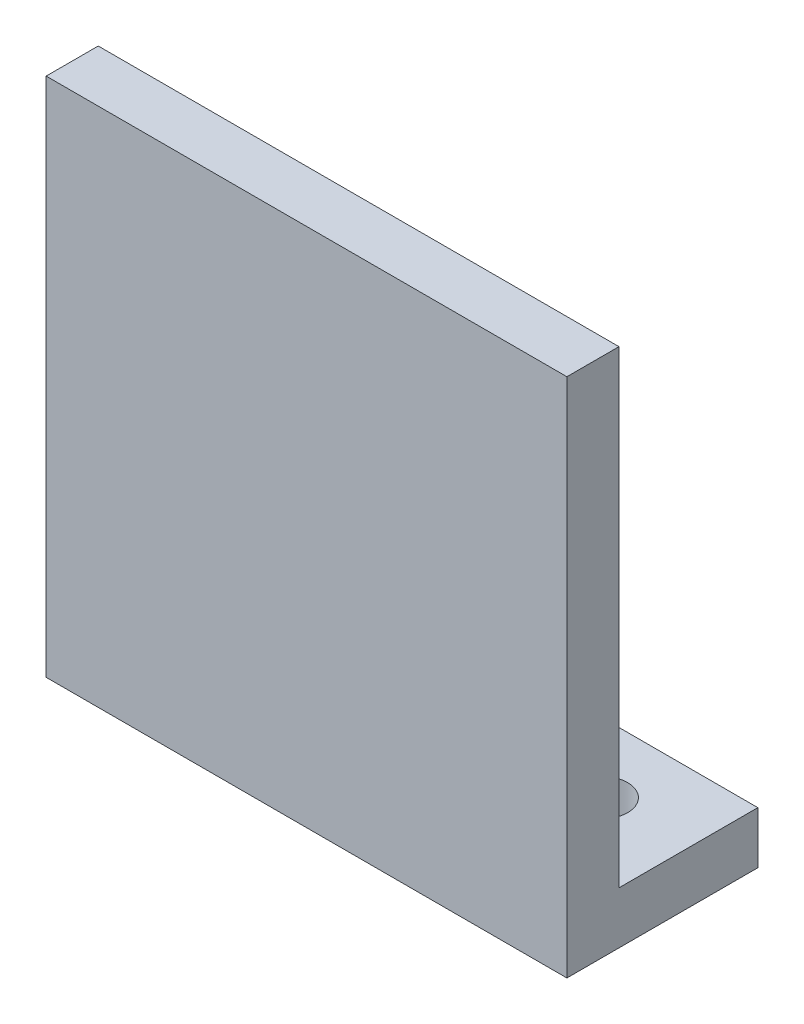
from build123d import *

# Parameters (mm, degrees)
SKETCH_1_W          = 30
SKETCH_1_H          = 30
EXTRUDE_1_DEPTH     = 3
SKETCH_2_W          = 30
SKETCH_2_H          = 3
EXTRUDE_2_DEPTH     = 8
EXTRUDE_3_DEPTH     = 2
SKETCH_4_R          = 1.5
CUT_EXTRUDE_1_DEPTH = 32.906112399


with BuildPart() as part:
    # 草图1 → 凸台-拉伸1 (new body)
    with BuildSketch(Plane.XY):
        Rectangle(SKETCH_1_W, SKETCH_1_H)
    extrude(amount=EXTRUDE_1_DEPTH)

    # 草图2 → 凸台-拉伸2 (add)
    with BuildSketch(Plane(origin=(0, 0, 0), x_dir=(-1, 0, 0), z_dir=(0, 0, -1))):
        with Locations((0, -13.5)):
            Rectangle(SKETCH_2_W, SKETCH_2_H)
    extrude(amount=EXTRUDE_2_DEPTH)

    # 草图3 → 凸台-拉伸3 (add)
    with BuildSketch(Plane(origin=(0, 0, 0), x_dir=(-1, 0, 0), z_dir=(0, 0, -1))):
        with BuildLine():
            Line((-2.305106483, 11.311404977), (-2.027743838, 11.566704685))
            add(Edge.make_bspline(
                [(-2.027743838, 11.566704685), (-1.794878972, 11.457790237), (-1.355574197, 11.252320696), (-0.747856089, 10.942285903), (-0.229982958, 10.649795688), (0.194428064, 10.374755127), (0.533566886, 10.121882158), (0.77438392, 9.881751463), (0.944974603, 9.664968691), (1.015639241, 9.391415806), (0.9966854, 9.097589735), (0.941039457, 8.786331398), (0.817795551, 8.5236158), (0.633519261, 8.332982487), (0.449181288, 8.195889891), (0.302760924, 8.088135642), (0.197092176, 8.017364927), (0.134764911, 7.999081008), (0.112361118, 7.992508778)],
                knots=[0, 0, 0, 0, 2.197927662, 4.146439677, 5.832238005, 7.279845715, 8.471106398, 9.436605479, 10.191661816, 10.788881907, 11.804124267, 12.685011878, 13.484502328, 14.241053406, 14.92571184, 15.446805523, 15.80115196, 16, 16, 16, 16], degree=3))
            add(Edge.make_bspline(
                [(0.112361118, 7.992508778), (0.050011554, 8.002947143), (-0.08737732, 8.02594835), (-0.259956516, 8.196857468), (-0.416014276, 8.442101169), (-0.49556336, 8.644926258), (-0.540071468, 8.758407901)],
                knots=[0, 0, 0, 0, 0.700838763, 1.544316304, 2.626032788, 4, 4, 4, 4], degree=3))
            add(Edge.make_bspline(
                [(-0.540071468, 8.758407901), (-0.5821962, 8.852359749), (-0.669510424, 9.047098852), (-0.824057914, 9.340433436), (-1.009761281, 9.641406724), (-1.212425661, 9.95948938), (-1.451127048, 10.280678596), (-1.709872913, 10.617383427), (-1.996269827, 10.962872749), (-2.200425668, 11.193269267), (-2.305106483, 11.311404977)],
                knots=[0, 0, 0, 0, 0.792668784, 1.643007677, 2.550308334, 3.515107773, 4.545787362, 5.629874198, 6.784719067, 8, 8, 8, 8], degree=3))
        make_face()
        with BuildLine():
            Line((-10.673263566, 7.822308973), (6.806886784, 7.822308973))
            Line((6.806886784, 7.822308973), (8.294559155, 9.183907414))
            Line((8.294559155, 9.183907414), (10.340108664, 7.311709558))
            Line((10.340108664, 7.311709558), (-7.697918825, 7.311709558))
            add(Edge.make_bspline(
                [(-7.697918825, 7.311709558), (-7.881871988, 7.308656331), (-8.247237029, 7.302592056), (-8.789546429, 7.25479995), (-9.319932334, 7.173180033), (-9.666114906, 7.095155579), (-9.838023782, 7.056409851)],
                knots=[0, 0, 0, 0, 1.02169224, 2.029269967, 3.021366146, 4, 4, 4, 4], degree=3))
            Line((-9.838023782, 7.056409851), (-10.673263566, 7.822308973))
        make_face()
        with BuildLine():
            Line((-4.073293347, 6.801110143), (-2.399661931, 5.439511702))
            Line((-2.399661931, 5.439511702), (-3.329457162, 5.184211995))
            add(Edge.make_bspline(
                [(-3.329457162, 5.184211995), (-3.661918376, 4.911100535), (-4.308266223, 4.38013633), (-5.275377087, 3.641671086), (-6.20188694, 2.972304041), (-7.094304982, 2.384361746), (-7.944987667, 1.862571734), (-8.76101121, 1.42223379), (-9.537567982, 1.049381648), (-10.053055168, 0.85340936), (-10.301345473, 0.759017063)],
                knots=[0, 0, 0, 0, 1.244563663, 2.419593658, 3.519436122, 4.550355101, 5.510468856, 6.405273195, 7.231881577, 8, 8, 8, 8], degree=3))
            Line((-10.301345473, 0.759017063), (-10.39590092, 1.014316771))
            add(Edge.make_bspline(
                [(-10.39590092, 1.014316771), (-10.017360387, 1.257610495), (-9.271761863, 1.736817941), (-8.210938681, 2.507364265), (-7.222105067, 3.311601244), (-6.458376899, 4.010201777), (-5.891338542, 4.563771343), (-5.510356994, 4.954154228), (-5.169522327, 5.319561824), (-4.868268622, 5.659752471), (-4.609963017, 5.977639283), (-4.390692723, 6.270958293), (-4.211876273, 6.540564482), (-4.117256895, 6.718455576), (-4.073293347, 6.801110143)],
                knots=[0, 0, 0, 0, 1.874567547, 3.692272479, 5.459531722, 7.182386108, 8.002686949, 8.761086549, 9.454870534, 10.08449878, 10.653979193, 11.160886839, 11.610118005, 12, 12, 12, 12], degree=3))
        make_face()
        with BuildLine():
            Line((2.157910627, 6.205410825), (2.343869674, 6.545810435))
            add(Edge.make_bspline(
                [(2.343869674, 6.545810435), (2.605834901, 6.436341272), (3.112201517, 6.224742464), (3.838791155, 5.904957081), (4.5109758, 5.606334574), (5.126868337, 5.32410298), (5.683835605, 5.050933425), (6.18816715, 4.801822938), (6.633579267, 4.564873458), (7.024336582, 4.343514345), (7.367605722, 4.13296053), (7.659729552, 3.917895038), (7.913118437, 3.70773837), (8.117652642, 3.493912706), (8.281765506, 3.281612264), (8.390719488, 3.064564894), (8.468546645, 2.849731388), (8.476569277, 2.703294503), (8.480518201, 2.631214919)],
                knots=[0, 0, 0, 0, 1.812650006, 3.50376826, 5.068178675, 6.508778607, 7.828769435, 9.028683626, 10.099947299, 11.049250256, 11.896072215, 12.668859108, 13.363683509, 13.994673249, 14.555440601, 15.068439001, 15.541464367, 16, 16, 16, 16], degree=3))
            add(Edge.make_bspline(
                [(8.480518201, 2.631214919), (8.476404976, 2.582724581), (8.467267846, 2.475007981), (8.423484243, 2.297731425), (8.344229944, 2.09247344), (8.25102173, 1.867292552), (8.147973226, 1.655779591), (8.0404517, 1.495783125), (7.940944184, 1.382250748), (7.860971901, 1.362739725), (7.828085615, 1.354716381)],
                knots=[0, 0, 0, 0, 0.783511922, 1.740496043, 2.929679364, 4.326021141, 5.673987734, 6.697847245, 7.464527372, 8, 8, 8, 8], degree=3))
            add(Edge.make_bspline(
                [(7.828085615, 1.354716381), (7.778254634, 1.363823494), (7.665304798, 1.384466213), (7.508869781, 1.514426132), (7.33907668, 1.700823102), (7.236160537, 1.861095257), (7.178804877, 1.950415698)],
                knots=[0, 0, 0, 0, 0.659298193, 1.494404119, 2.603619392, 4, 4, 4, 4], degree=3))
            add(Edge.make_bspline(
                [(7.178804877, 1.950415698), (7.05077175, 2.120334623), (6.790528866, 2.465715476), (6.351980668, 2.957201814), (5.879949473, 3.445544273), (5.448204004, 3.838103862), (5.071308787, 4.156382587), (4.753669197, 4.410381652), (4.40326017, 4.679131769), (4.018624623, 4.958216125), (3.602200666, 5.252417066), (3.150171333, 5.557368175), (2.666341418, 5.878628105), (2.330498068, 6.094484039), (2.157910627, 6.205410825)],
                knots=[0, 0, 0, 0, 1.156150992, 2.350017333, 3.577869138, 4.847260874, 5.520054583, 6.25951119, 7.058018181, 7.920529522, 8.842772332, 9.829688202, 10.884692641, 12, 12, 12, 12], degree=3))
        make_face()
        with BuildLine():
            Line((4.852740874, 2.546115016), (3.922945643, 2.120615504))
            add(Edge.make_bspline(
                [(3.922945643, 2.120615504), (3.778143809, 1.82421938), (3.495891085, 1.246473844), (3.04537482, 0.421735242), (2.600207435, -0.348814984), (2.14910532, -1.060375348), (1.693094833, -1.712036898), (1.235082828, -2.306624664), (0.778013133, -2.84595086), (0.454910586, -3.169143954), (0.298320165, -3.325778259)],
                knots=[0, 0, 0, 0, 1.204096835, 2.347067039, 3.429841553, 4.452343735, 5.421672099, 6.332275, 7.191743416, 8, 8, 8, 8], degree=3))
            add(Edge.make_bspline(
                [(0.298320165, -3.325778259), (0.467371652, -3.460680933), (0.804829073, -3.729971132), (1.331492998, -4.10738687), (1.88197699, -4.447975474), (2.445743055, -4.770543562), (3.033662777, -5.053897321), (3.636746234, -5.318574444), (4.26028991, -5.550228819), (4.903129981, -5.75541281), (5.562944375, -5.935964084), (6.244219172, -6.082699716), (6.942165498, -6.206022022), (7.660409719, -6.300592633), (8.396506838, -6.36624034), (9.152451449, -6.40361966), (9.926304872, -6.414121821), (10.448350425, -6.397679491), (10.712026756, -6.38937475)],
                knots=[0, 0, 0, 0, 0.934343793, 1.865119626, 2.797078927, 3.729977298, 4.669861379, 5.615133413, 6.574575313, 7.542078903, 8.529761733, 9.528696818, 10.55179032, 11.591106972, 12.657506233, 13.743698561, 14.860380514, 16, 16, 16, 16], degree=3))
            Line((10.712026756, -6.38937475), (10.712026756, -6.644674457))
            add(Edge.make_bspline(
                [(10.712026756, -6.644674457), (10.593551143, -6.694413754), (10.368009945, -6.789102106), (10.057143895, -6.952034998), (9.783930664, -7.117072932), (9.551528569, -7.293653878), (9.360617359, -7.47996839), (9.209175094, -7.673945806), (9.097776051, -7.877179087), (9.057887744, -8.021061239), (9.03839534, -8.091372801)],
                knots=[0, 0, 0, 0, 1.342228497, 2.555191034, 3.66432754, 4.674491749, 5.598393505, 6.443878379, 7.239562799, 8, 8, 8, 8], degree=3))
            add(Edge.make_bspline(
                [(9.03839534, -8.091372801), (8.782895007, -8.053774011), (8.278227338, -7.979508381), (7.534842543, -7.847534784), (6.814769096, -7.696310098), (6.119241864, -7.525795044), (5.446927157, -7.340877009), (4.800151359, -7.136303868), (4.178578687, -6.9112148), (3.578469668, -6.672573488), (3.001920816, -6.414512859), (2.449407864, -6.137513581), (1.922822868, -5.839647417), (1.417450221, -5.528897707), (0.937404482, -5.197825017), (0.484023103, -4.846060424), (0.04937862, -4.482669543), (-0.220108602, -4.221530185), (-0.354112421, -4.091677381)],
                knots=[0, 0, 0, 0, 1.193225404, 2.35687475, 3.487949324, 4.592342887, 5.665273416, 6.709260648, 7.725799817, 8.71919469, 9.692664653, 10.643553074, 11.573847077, 12.487217793, 13.384029152, 14.266643611, 15.138080182, 16, 16, 16, 16], degree=3))
            add(Edge.make_bspline(
                [(-0.354112421, -4.091677381), (-0.687954777, -4.336238901), (-1.36469164, -4.831993238), (-2.457220721, -5.491503236), (-3.616311833, -6.105133202), (-4.849137014, -6.663426184), (-6.155501273, -7.164833907), (-7.532331542, -7.620724798), (-8.982918656, -8.017005113), (-9.979873138, -8.235475251), (-10.487304519, -8.346672508)],
                knots=[0, 0, 0, 0, 0.895891654, 1.816075456, 2.760633746, 3.735148952, 4.745060468, 5.78983574, 6.875067292, 8, 8, 8, 8], degree=3))
            Line((-10.487304519, -8.346672508), (-10.581859967, -8.006272898))
            add(Edge.make_bspline(
                [(-10.581859967, -8.006272898), (-10.110834321, -7.868872221), (-9.183269378, -7.598296613), (-7.83804971, -7.122751604), (-6.554032396, -6.606440296), (-5.334681224, -6.042862661), (-4.178464198, -5.435332451), (-3.08902742, -4.779483566), (-2.056181335, -4.088247104), (-1.415110101, -3.578144674), (-1.097948607, -3.325778259)],
                knots=[0, 0, 0, 0, 1.105387851, 2.176779602, 3.213352566, 4.222748287, 5.202262626, 6.154710299, 7.087067382, 8, 8, 8, 8], degree=3))
            add(Edge.make_bspline(
                [(-1.097948607, -3.325778259), (-1.260055043, -3.106837933), (-1.589883827, -2.661372453), (-2.048484783, -1.948011623), (-2.492442326, -1.18834854), (-2.920242442, -0.381785035), (-3.331401412, 0.471478138), (-3.720806012, 1.374691494), (-4.095894147, 2.32503193), (-4.327447855, 2.979277785), (-4.44521144, 3.312014139)],
                knots=[0, 0, 0, 0, 0.875624334, 1.781583235, 2.724691925, 3.703827006, 4.716008585, 5.76891757, 6.865316105, 8, 8, 8, 8], degree=3))
            Line((-4.44521144, 3.312014139), (-4.073293347, 3.397114042))
            add(Edge.make_bspline(
                [(-4.073293347, 3.397114042), (-3.933134319, 3.09897675), (-3.657432916, 2.512522417), (-3.221796476, 1.660810191), (-2.775613682, 0.850452935), (-2.31503743, 0.084755389), (-1.845304898, -0.639422738), (-1.362545341, -1.320629255), (-0.870186722, -1.961636505), (-0.524078683, -2.362851182), (-0.354112421, -2.559879136)],
                knots=[0, 0, 0, 0, 1.121804492, 2.206658228, 3.257157778, 4.27140299, 5.248867787, 6.195889759, 7.114040017, 8, 8, 8, 8], degree=3))
            add(Edge.make_bspline(
                [(-0.354112421, -2.559879136), (-0.192509947, -2.36144819), (0.135702757, -1.958437299), (0.582016589, -1.299215138), (1.007149635, -0.591689341), (1.404711522, 0.170425626), (1.772606892, 0.985808869), (2.115397305, 1.853872388), (2.43500954, 2.774833691), (2.620849746, 3.412007893), (2.715787766, 3.737513652)],
                knots=[0, 0, 0, 0, 0.869716896, 1.76638467, 2.70366274, 3.675080695, 4.68700289, 5.743663211, 6.847331519, 8, 8, 8, 8], degree=3))
            Line((2.715787766, 3.737513652), (4.852740874, 2.546115016))
        make_face()
    extrude(amount=EXTRUDE_3_DEPTH)

    # 草图4 → 切除-拉伸1 (cut, through all)
    with BuildSketch(Plane(origin=(0, -12, 0), x_dir=(1, 0, 0), z_dir=(0, 1, 0))):
        with Locations(Location((-10, 3.999978925, 0), (0, 0, 180))):
            Circle(SKETCH_4_R)
        with Locations((10, 3.999978925)):
            Circle(SKETCH_4_R)
    extrude(amount=-CUT_EXTRUDE_1_DEPTH, mode=Mode.SUBTRACT)


solid = part.part
